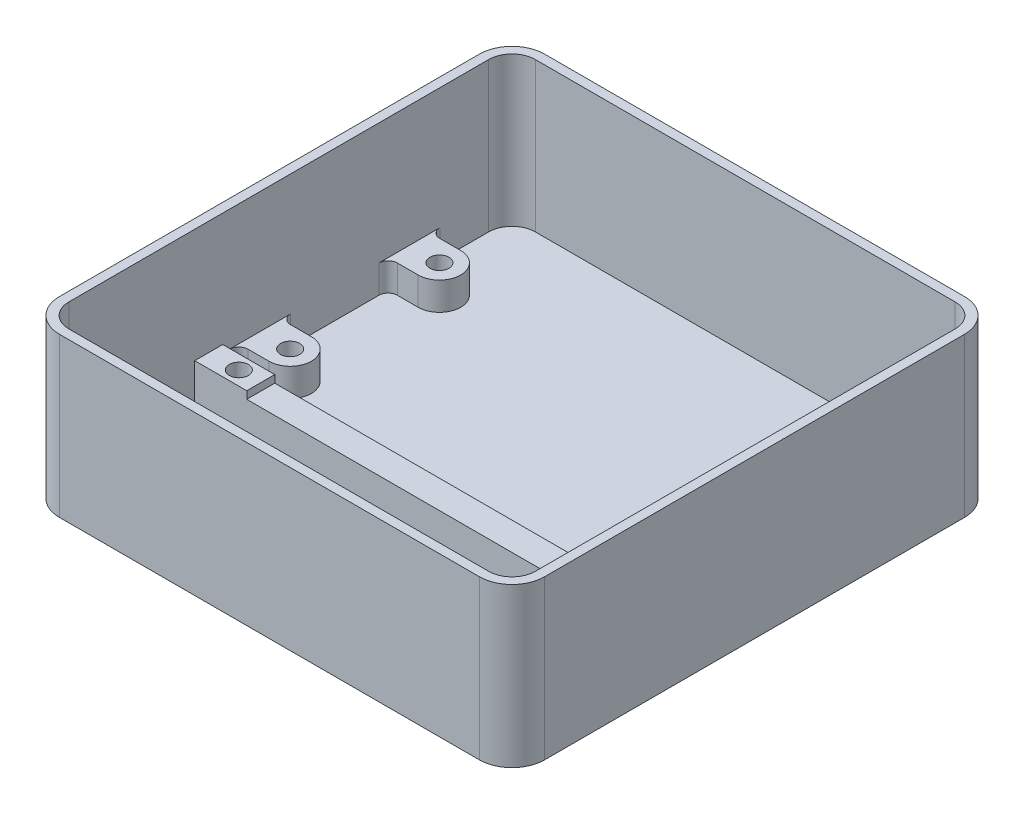
from build123d import *

# Parameters (mm, degrees)
BOSS_EXTRUDE1_DEPTH = 32
SHELL1_T            = 2
SKETCH2_R           = 2.05
SKETCH2_W           = 100
SKETCH2_H           = 6
BOSS_EXTRUDE2_DEPTH = 6
FILLET1_R           = 2
SKETCH3_W           = 11.15
SKETCH3_H           = 6
BOSS_EXTRUDE3_DEPTH = 1.6
SKETCH4_R           = 2.05
CUT_EXTRUDE1_DEPTH  = 7.6


with BuildPart() as part:
    # Sketch1 → Boss-Extrude1 (new body)
    with BuildSketch(Plane(origin=(0, 0, 0), x_dir=(1, 0, 0), z_dir=(0, 1, 0))):
        with BuildLine():
            Line((-45, 50), (45, 50))
            ThreePointArc((45, 50), (48.535533906, 48.535533906), (50, 45))
            Line((50, 45), (50, -45))
            ThreePointArc((50, -45), (48.535533906, -48.535533906), (45, -50))
            Line((45, -50), (-45, -50))
            ThreePointArc((-45, -50), (-48.535533906, -48.535533906), (-50, -45))
            Line((-50, -45), (-50, 45))
            ThreePointArc((-50, 45), (-48.535533906, 48.535533906), (-45, 50))
        make_face()
    extrude(amount=BOSS_EXTRUDE1_DEPTH)

    # Shell1
    shell1_openings = [part.faces().sort_by_distance(p)[0] for p in [
        (0, 32, 0),
    ]]
    offset(amount=SHELL1_T, openings=shell1_openings, kind=Kind.INTERSECTION)

    # Sketch2 → Boss-Extrude2 (add)
    # profile 1 of 5: a face of its own
    with BuildSketch(Plane(origin=(0, 0, 0), x_dir=(1, 0, 0), z_dir=(0, 1, 0))):
        with BuildLine():
            Line((-43.55, 32.55), (-50, 32.55))
            Line((-50, 32.55), (-50, 23.45))
            Line((-50, 23.45), (-43.55, 23.45))
            ThreePointArc((-43.55, 23.45), (-39, 28), (-43.55, 32.55))
        make_face()
        with Locations(Location((-43.55, 28, 0), (0, 0, 270))):
            Circle(SKETCH2_R, mode=Mode.SUBTRACT)
    # profile 2 of 5: a face of its own
    with BuildSketch(Plane(origin=(0, 0, 0), x_dir=(1, 0, 0), z_dir=(0, 1, 0))):
        with BuildLine():
            Line((-43.55, 0.55), (-50, 0.55))
            Line((-50, 0.55), (-50, -8.55))
            Line((-50, -8.55), (-43.55, -8.55))
            ThreePointArc((-43.55, -8.55), (-39, -4), (-43.55, 0.55))
        make_face()
        with Locations(Location((-43.55, -4, 0), (0, 0, 270))):
            Circle(SKETCH2_R, mode=Mode.SUBTRACT)
    # profile 3 of 5: a face of its own
    with BuildSketch(Plane(origin=(0, 0, 0), x_dir=(1, 0, 0), z_dir=(0, 1, 0))):
        with BuildLine():
            Line((43.55, 0.55), (50, 0.55))
            Line((50, 0.55), (50, -8.55))
            Line((50, -8.55), (43.55, -8.55))
            ThreePointArc((43.55, -8.55), (39, -4), (43.55, 0.55))
        make_face()
        with Locations(Location((43.55, -4, 0), (0, 0, 270))):
            Circle(SKETCH2_R, mode=Mode.SUBTRACT)
    # profile 4 of 5: a face of its own
    with BuildSketch(Plane(origin=(0, 0, 0), x_dir=(1, 0, 0), z_dir=(0, 1, 0))):
        with BuildLine():
            Line((43.55, 32.55), (50, 32.55))
            Line((50, 32.55), (50, 23.45))
            Line((50, 23.45), (43.55, 23.45))
            ThreePointArc((43.55, 23.45), (39, 28), (43.55, 32.55))
        make_face()
        with Locations(Location((43.55, 28, 0), (0, 0, 270))):
            Circle(SKETCH2_R, mode=Mode.SUBTRACT)
    # profile 5 of 5: a face of its own
    with BuildSketch(Plane(origin=(0, 0, 0), x_dir=(1, 0, 0), z_dir=(0, 1, 0))):
        with Locations((0, -15)):
            Rectangle(SKETCH2_W, SKETCH2_H)
    extrude(amount=BOSS_EXTRUDE2_DEPTH)

    # Fillet1
    fillet1_edges = [part.edges().sort_by_distance(p)[0] for p in [
        (50, 3, 8.55),
        (50, 3, -0.55),
        (50, 3, -23.45),
        (50, 3, -32.55),
        (-50, 3, -23.45),
        (-50, 3, -32.55),
        (-50, 3, -0.55),
        (-50, 3, 8.55),
    ]]
    fillet(fillet1_edges, radius=FILLET1_R)

    # Sketch3 → Boss-Extrude3 (add)
    with BuildSketch(Plane(origin=(0, 6, 0), x_dir=(1, 0, 0), z_dir=(0, 1, 0))):
        with Locations((-44.425, -15)):
            Rectangle(SKETCH3_W, SKETCH3_H)
        with Locations((44.425, -15)):
            Rectangle(SKETCH3_W, SKETCH3_H)
    extrude(amount=BOSS_EXTRUDE3_DEPTH)

    # Sketch4 → Cut-Extrude1 (cut)
    with BuildSketch(Plane(origin=(0, 7.6, 0), x_dir=(1, 0, 0), z_dir=(0, 1, 0))):
        with Locations(Location((-43.55, -15, 0), (0, 0, 270))):
            Circle(SKETCH4_R)
        with Locations(Location((43.55, -15, 0), (0, 0, 270))):
            Circle(SKETCH4_R)
    extrude(amount=-CUT_EXTRUDE1_DEPTH, mode=Mode.SUBTRACT)


solid = part.part
